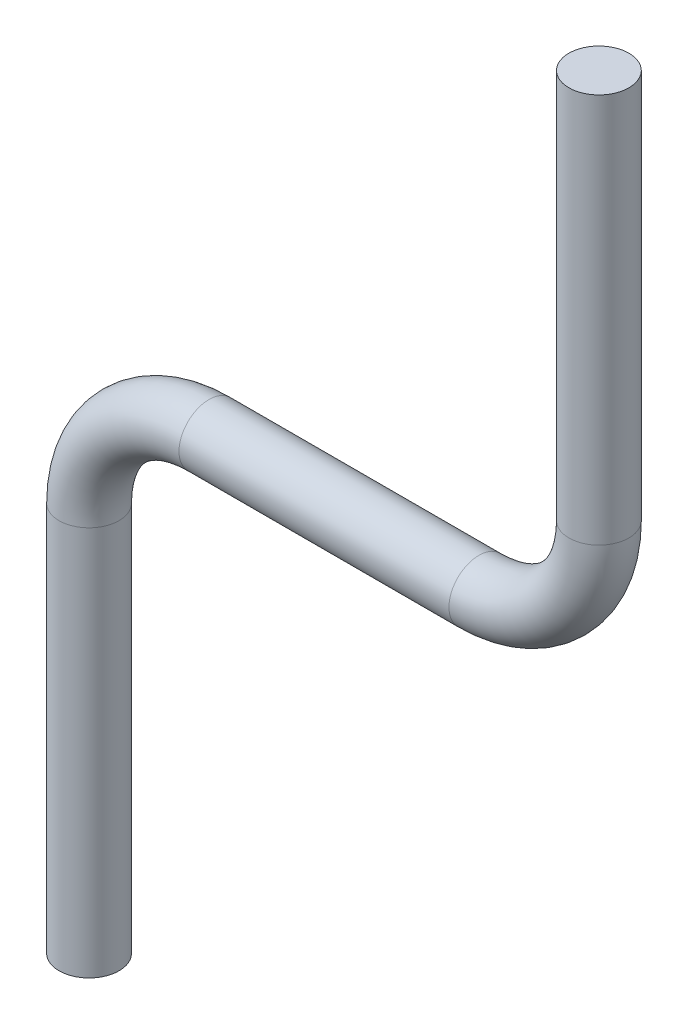
from build123d import *

# Parameters (mm, degrees)
SKETCH_18_R = 2


with BuildPart() as part:
    # ｽｲｰﾌﾟ6: sweep along a path in ｽｹｯﾁ19
    with BuildLine(Plane.XY) as sweep_6_path:
        Line((0, 0), (0, 26))
        ThreePointArc((0, 26), (2.343145751, 31.656854249), (8, 34))
        Line((8, 34), (26, 34))
        ThreePointArc((26, 34), (31.656854249, 36.343145751), (34, 42))
        Line((34, 42), (34, 68))
    # ｽｹｯﾁ18 → ｽｲｰﾌﾟ6 (sweep)
    with BuildSketch(Plane(origin=(0, 0, 0), x_dir=(1, 0, 0), z_dir=(0, 1, 0))):
        Circle(SKETCH_18_R)
    sweep(path=sweep_6_path.line)


solid = part.part
